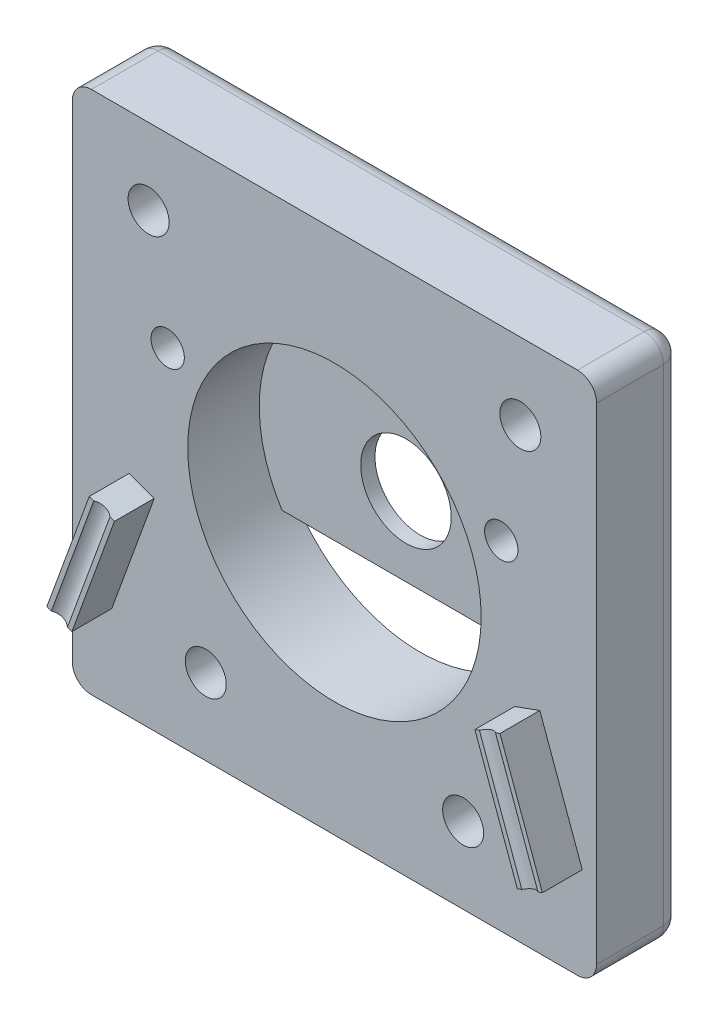
from build123d import *

# Parameters (mm, degrees)
SKETCH1_W           = 55
SKETCH1_H           = 55
BOSS_EXTRUDE1_DEPTH = 9
SKETCH3_R           = 1.75
SKETCH3_R_2         = 2.15
CUT_EXTRUDE1_DEPTH  = 79.300702423
FILLET1_R           = 2
SKETCH4_R           = 4.25
CUT_EXTRUDE2_DEPTH  = 2.5
BOSS_EXTRUDE2_DEPTH = 13.027575483
BOSS_EXTRUDE3_DEPTH = 13.027575483
SKETCH7_R           = 15.392304845
CUT_EXTRUDE3_DEPTH  = 7.5
SKETCH8_R           = 4.75
CUT_EXTRUDE4_DEPTH  = 79.653460169
CUT_EXTRUDE5_DEPTH  = 79.653460169


with BuildPart() as part:
    # Sketch1 → Boss-Extrude1 (new body)
    with BuildSketch(Plane.XY):
        with Locations((27.5, 27.5)):
            Rectangle(SKETCH1_W, SKETCH1_H)
    extrude(amount=BOSS_EXTRUDE1_DEPTH)

    # Sketch3 → Cut-Extrude1 (cut, through all)
    with BuildSketch(Plane(origin=(0, 0, 0), x_dir=(-1, 0, 0), z_dir=(0, 0, -1))):
        with Locations((-45, 35.5)):
            Circle(SKETCH3_R)
        with Locations((-47, 47)):
            Circle(SKETCH3_R_2)
        with Locations((-8, 47)):
            Circle(SKETCH3_R_2)
        with Locations((-14, 8)):
            Circle(SKETCH3_R_2)
        with Locations((-41, 8)):
            Circle(SKETCH3_R_2)
        with Locations((-10, 35.5)):
            Circle(SKETCH3_R)
    extrude(amount=-CUT_EXTRUDE1_DEPTH, mode=Mode.SUBTRACT)

    # Fillet1
    fillet1_edges = [part.edges().sort_by_distance(p)[0] for p in [
        (27.5, 55, 0),
        (55, 27.5, 0),
        (27.5, 0, 0),
        (0, 27.5, 0),
        (0, 55, 4.5),
        (55, 55, 4.5),
        (55, 0, 4.5),
        (0, 0, 4.5),
    ]]
    fillet(fillet1_edges, radius=FILLET1_R)

    # Sketch4 → Cut-Extrude2 (cut)
    with BuildSketch(Plane(origin=(0, 0, 0), x_dir=(-1, 0, 0), z_dir=(0, 0, -1))):
        with Locations((-47, 47)):
            Circle(SKETCH4_R)
        with Locations((-8, 47)):
            Circle(SKETCH4_R)
        with Locations((-14, 8)):
            Circle(SKETCH4_R)
        with Locations((-41, 8)):
            Circle(SKETCH4_R)
    extrude(amount=-CUT_EXTRUDE2_DEPTH, mode=Mode.SUBTRACT)

    # Sketch5 → Boss-Extrude2 (add)
    with BuildSketch(Plane(origin=(3.091937938, -8.495029668, 0), x_dir=(0, 0, 1), z_dir=(-0.3420201433256653, 0.9396926207859098, 0))):
        with BuildLine():
            Line((13.177619471, 53.639405858), (9, 53.639405858))
            Line((9, 53.639405858), (9, 50.839405858))
            Line((9, 50.839405858), (13.177619471, 50.839405858))
            Line((13.177619471, 50.839405858), (13.177619471, 51.339405858))
            ThreePointArc((13.177619471, 51.339405858), (12.85, 52.239405858), (13.177619471, 53.139405858))
            Line((13.177619471, 53.139405858), (13.177619471, 53.639405858))
        make_face()
    extrude(amount=BOSS_EXTRUDE2_DEPTH)

    # Sketch6 → Boss-Extrude3 (add)
    with BuildSketch(Plane(origin=(3.341839876, 9.181629599, 0), x_dir=(0, 0, 1), z_dir=(-0.3420201433256654, -0.9396926207859095, 0))):
        with BuildLine():
            Line((13.177619471, 1.956311715), (9, 1.956311715))
            Line((9, 1.956311715), (9, -0.843688285))
            Line((9, -0.843688285), (13.177619471, -0.843688285))
            Line((13.177619471, -0.843688285), (13.177619471, -0.343688285))
            ThreePointArc((13.177619471, -0.343688285), (12.85, 0.556311715), (13.177619471, 1.456311715))
            Line((13.177619471, 1.456311715), (13.177619471, 1.956311715))
        make_face()
    extrude(amount=-BOSS_EXTRUDE3_DEPTH)

    # Sketch7 → Cut-Extrude3 (cut)
    with BuildSketch(Plane.XY.offset(9)):
        with Locations((27.5, 27.5)):
            Circle(SKETCH7_R)
    extrude(amount=-CUT_EXTRUDE3_DEPTH, mode=Mode.SUBTRACT)

    # Sketch8 → Cut-Extrude4 (cut, through all)
    with BuildSketch(Plane.XY.offset(1.5)):
        with Locations((27.5, 27.5)):
            Circle(SKETCH8_R)
    extrude(amount=-CUT_EXTRUDE4_DEPTH, mode=Mode.SUBTRACT)

    # Sketch10 → Cut-Extrude5 (cut, through all)
    with BuildSketch(Plane.XY.offset(1.5)):
        with BuildLine():
            Line((14.5, 19.258455942), (40.5, 19.258455942))
            ThreePointArc((40.5, 19.258455942), (27.5, 12.107695155), (14.5, 19.258455942))
        make_face()
    extrude(amount=-CUT_EXTRUDE5_DEPTH, mode=Mode.SUBTRACT)


solid = part.part
